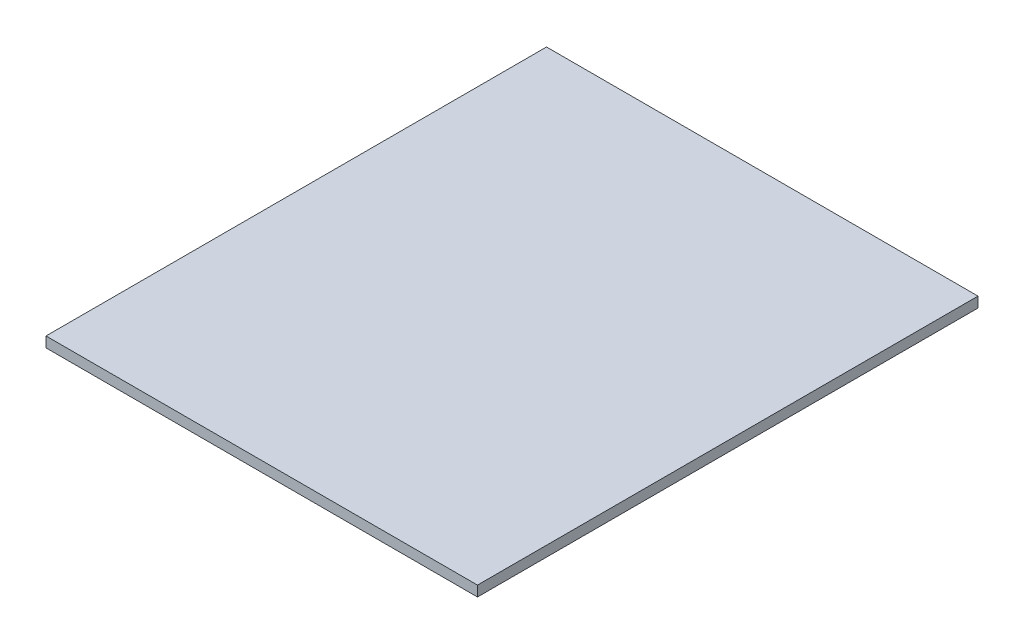
from build123d import *

# Parameters (mm, degrees)
ESBO_O1_W                = 238
ESBO_O1_H                = 250
RESSALTO_EXTRUS_O1_DEPTH = 6
ESBO_O2_W                = 250
ESBO_O2_H                = 6
RESSALTO_EXTRUS_O2_DEPTH = 12
ESBO_O3_W                = 250
ESBO_O3_H                = 6
RESSALTO_EXTRUS_O3_DEPTH = 40


with BuildPart() as part:
    # Esboço1 → Ressalto-extrusão1 (new body)
    with BuildSketch(Plane(origin=(0, 0, 0), x_dir=(1, 0, 0), z_dir=(0, 1, 0))):
        with Locations((119, 125)):
            Rectangle(ESBO_O1_W, ESBO_O1_H)
    extrude(amount=RESSALTO_EXTRUS_O1_DEPTH)

    # Esboço2 → Ressalto-extrusão2 (add)
    with BuildSketch(Plane.ZY):
        with Locations((-125, 3)):
            Rectangle(ESBO_O2_W, ESBO_O2_H)
    extrude(amount=RESSALTO_EXTRUS_O2_DEPTH)

    # Esboço3 → Ressalto-extrusão3 (add)
    with BuildSketch(Plane(origin=(0, 0, -250), x_dir=(-1, 0, 0), z_dir=(0, 0, -1))):
        with Locations((-113, 3)):
            Rectangle(ESBO_O3_W, ESBO_O3_H)
    extrude(amount=RESSALTO_EXTRUS_O3_DEPTH)


solid = part.part
